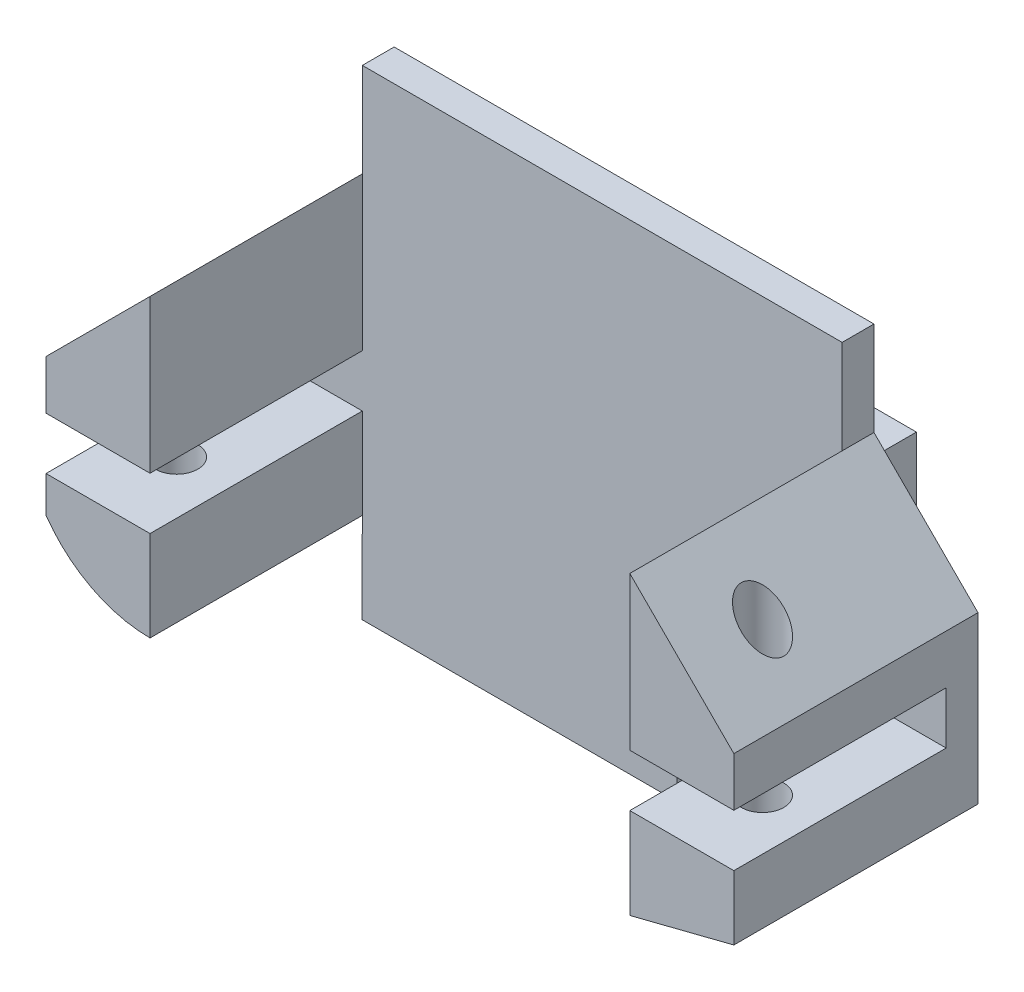
from build123d import *

# Parameters (mm, degrees)
SKETCH_1_W          = 32.4
SKETCH_1_H          = 30
EXTRUDE_1_DEPTH     = 1.5
SKETCH_2_W          = 4.9
SKETCH_2_H          = 8.52
EXTRUDE_2_DEPTH     = 10
CUT_EXTRUDE_1_DEPTH = 11.5
SKETCH_4_R          = 1
CUT_EXTRUDE_2_DEPTH = 31.5
CUT_EXTRUDE_3_DEPTH = 10
EXTRUDE_3_DEPTH     = 2
CUT_EXTRUDE_4_DEPTH = 6
SKETCH_8_R          = 2.25
CUT_EXTRUDE_5_DEPTH = 2


with BuildPart() as part:
    # 草图1 → 凸台-拉伸1 (new body)
    with BuildSketch(Plane.XY):
        with Locations((-0.362675268, 2.133428793)):
            Rectangle(SKETCH_1_W, SKETCH_1_H)
    extrude(amount=EXTRUDE_1_DEPTH)

    # 草图2 → 凸台-拉伸2 (add)
    with BuildSketch(Plane.XY.offset(1.5)):
        with Locations((-14.112675268, -1.225199495)):
            Rectangle(SKETCH_2_W, SKETCH_2_H)
        Polygon((-16.562675268, 5.494800505), (-11.662675268, 5.494800505), (-11.662675268, 12.70812694), (-16.562675268, 7.80812694), align=None)
        Polygon((10.937324732, 5.494800505), (10.937324732, 12.70812694), (15.837324732, 7.80812694), (15.837324732, 5.494800505), align=None)
        Polygon((10.937324732, 3.034800505), (15.837324732, 3.034800505), (15.837324732, 0), (10.937324732, -1.245199495), align=None)
    extrude(amount=EXTRUDE_2_DEPTH)

    # 草图3 → 切除-拉伸1 (cut)
    with BuildSketch(Plane.XY.offset(1.5)):
        Polygon((-16.562675268, 7.80812694), (-11.662675268, 12.70812694), (-11.662675268, 17.133428793), (-16.562675268, 17.133428793), align=None)
        Polygon((15.837324732, 7.80812694), (10.937324732, 12.70812694), (10.937324732, 17.133428793), (15.837324732, 17.133428793), align=None)
        Polygon((-16.562675268, -12.866571207), (-16.562675268, -8.702000753), (-16.562675268, -5.485199495), (3.157324732, -5.485199495), (3.157324732, -1.245199495), (10.937324732, -1.245199495), (15.837324732, 0), (15.837324732, -12.866571207), align=None)
    extrude(amount=-CUT_EXTRUDE_1_DEPTH, mode=Mode.SUBTRACT)

    # 草图4 → 切除-拉伸2 (cut)
    with BuildSketch(Plane.XZ.offset(5.485199495)):
        with Locations(Location((-14.162675268, 7.75, 0), (0, 0, 180))):
            Circle(SKETCH_4_R)
        with Locations(Location((13.437324732, 7.75, 0), (0, 0, 270))):
            Circle(SKETCH_4_R)
    extrude(amount=-CUT_EXTRUDE_2_DEPTH, mode=Mode.SUBTRACT)

    # 草图5 → 切除-拉伸3 (cut)
    with BuildSketch(Plane.XY.offset(11.5)):
        with BuildLine():
            Line((-11.662675268, -5.485199495), (-11.662675268, -1.225199495))
            ThreePointArc((-11.662675268, -1.225199495), (-14.426273503, -0.547412969), (-16.562675268, 1.332123483))
            Line((-16.562675268, 1.332123483), (-16.562675268, -5.485199495))
            Line((-16.562675268, -5.485199495), (-11.662675268, -5.485199495))
        make_face()
    extrude(amount=-CUT_EXTRUDE_3_DEPTH, mode=Mode.SUBTRACT)

    # 草图6 → 凸台-拉伸3 (add)
    with BuildSketch(Plane(origin=(0, 0, 0), x_dir=(-1, 0, 0), z_dir=(0, 0, -1))):
        with BuildLine():
            Line((4.562675268, 9.133428793), (7.412675268, 9.133428793))
            ThreePointArc((7.412675268, 9.133428793), (9.412675268, 7.133428793), (7.412675268, 5.133428793))
            Line((7.412675268, 5.133428793), (4.562675268, 5.133428793))
            Line((4.562675268, 5.133428793), (4.562675268, 2.436720349))
            Line((4.562675268, 2.436720349), (11.662675268, 2.436720349))
            Line((11.662675268, 2.436720349), (11.662675268, 11.725210418))
            Line((11.662675268, 11.725210418), (4.562675268, 11.725210418))
            Line((4.562675268, 11.725210418), (4.562675268, 9.133428793))
        make_face()
        with BuildLine():
            Line((-5.287324731, 9.133428793), (-2.437324732, 9.133428793))
            Line((-2.437324732, 9.133428793), (-2.437324732, 11.725210418))
            Line((-2.437324732, 11.725210418), (-10.937324732, 11.725210418))
            Line((-10.937324732, 11.725210418), (-10.937324732, 2.436720349))
            Line((-10.937324732, 2.436720349), (-2.437324732, 2.436720349))
            Line((-2.437324732, 2.436720349), (-2.437324732, 5.133428793))
            Line((-2.437324732, 5.133428793), (-5.287324731, 5.133428793))
            ThreePointArc((-5.287324731, 5.133428793), (-7.287324731, 7.133428793), (-5.287324731, 9.133428793))
        make_face()
    extrude(amount=EXTRUDE_3_DEPTH)

    # 草图7 → 切除-拉伸4 (cut)
    with BuildSketch(Plane.XY.offset(1.5)):
        with BuildLine():
            Line((-16.562675268, 1.332123483), (-16.562675268, -5.485199495))
            Line((-16.562675268, -5.485199495), (-11.683364196, -5.485199495))
            Line((-11.683364196, -5.485199495), (-11.662675268, -1.225199495))
            ThreePointArc((-11.662675268, -1.225199495), (-14.426273503, -0.547412969), (-16.562675268, 1.332123483))
        make_face()
    extrude(amount=-CUT_EXTRUDE_4_DEPTH, mode=Mode.SUBTRACT)

    # 草图8 → 切除-拉伸5 (cut)
    with BuildSketch(Plane.XZ.offset(1.245199495)):
        with Locations((13.437324732, 7.75)):
            Circle(SKETCH_8_R)
        with Locations((-14.162675268, 7.75)):
            Circle(SKETCH_8_R)
    extrude(amount=-CUT_EXTRUDE_5_DEPTH, mode=Mode.SUBTRACT)


solid = part.part
